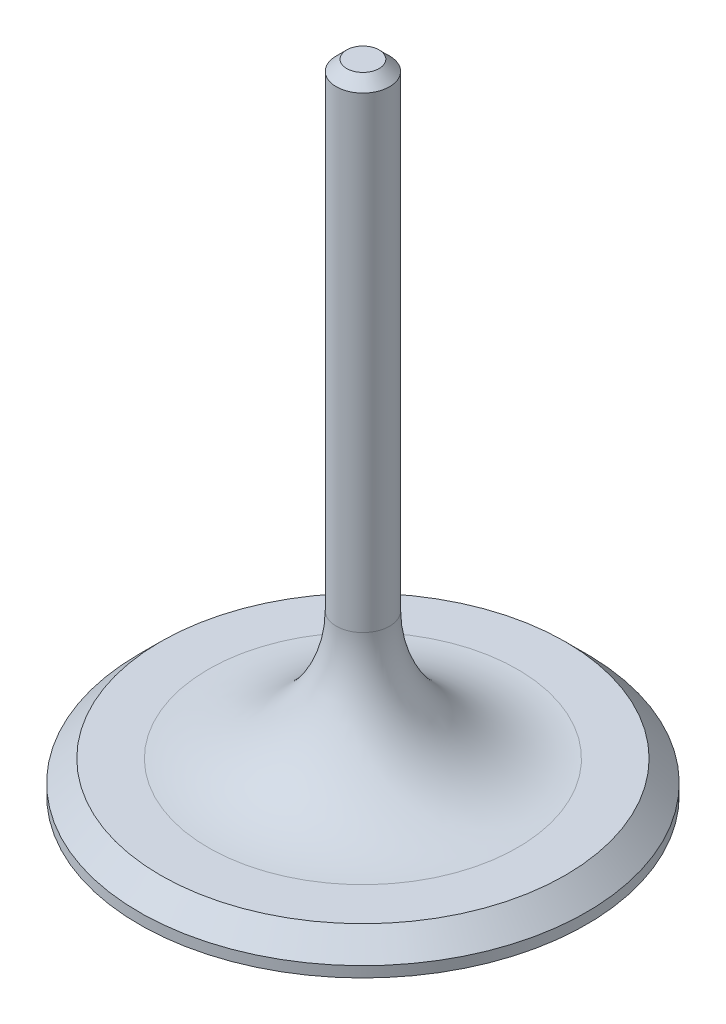
from build123d import *

# Parameters (mm, degrees)
CHAMFER1_SIZE = 1.25


with BuildPart() as part:
    # Sketch1 → Revolve1 (revolve)
    with BuildSketch(Plane.XY, mode=Mode.PRIVATE) as revolve1_sk:
        with BuildLine():
            Line((24.13, 3.81), (26.67, 1.27))
            Line((26.67, 1.27), (26.67, 0))
            Line((26.67, 0), (0, 0))
            Line((0, 0), (0, 76.02))
            Line((0, 76.02), (3.18, 76.02))
            Line((3.18, 76.02), (3.18, 19.06))
            ThreePointArc((3.18, 19.06), (7.646621587, 8.276621587), (18.43, 3.81))
            Line((18.43, 3.81), (24.13, 3.81))
        make_face()
    revolve(revolve1_sk.sketch.rotate(Axis((0, 76.02, 0), (0, -1, 0)), 180), axis=Axis((0, 76.02, 0), (0, -1, 0)))

    # Chamfer1
    chamfer1_edges = [part.edges().sort_by_distance(p)[0] for p in [
        (3.18, 76.02, 0),
    ]]
    chamfer(chamfer1_edges, length=CHAMFER1_SIZE)


solid = part.part
